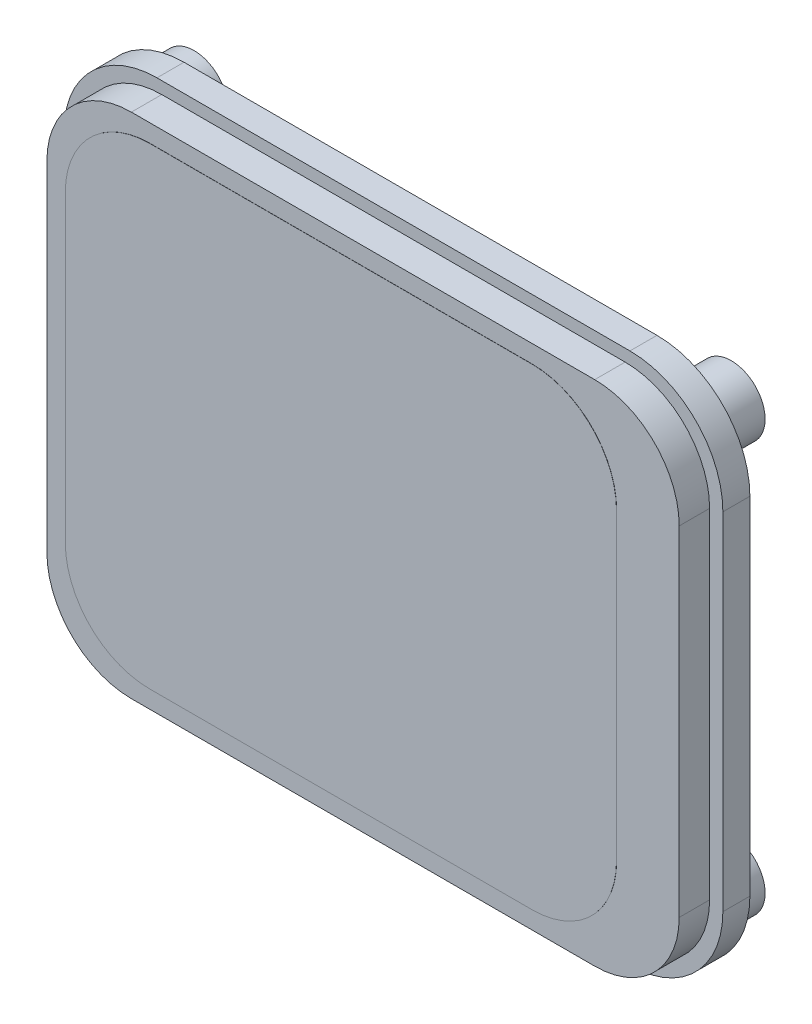
from build123d import *

# Parameters (mm, degrees)
BOSS_EXTRU_1_DEPTH = 0.01
BOSS_EXTRU_2_DEPTH = 1.8
BOSS_EXTRU_3_DEPTH = 1.6
ESQUISSE4_R        = 2
ESQUISSE4_R_2      = 1
BOSS_EXTRU_4_DEPTH = 2.5


with BuildPart() as part:
    # Esquisse1 → Boss.-Extru.1 (new body)
    with BuildSketch(Plane.XY):
        with BuildLine():
            Line((-11.315, -13.985), (11.315, -13.985))
            ThreePointArc((11.315, -13.985), (14.850533906, -12.520533906), (16.315, -8.985))
            Line((16.315, -8.985), (16.315, 8.985))
            ThreePointArc((16.315, 8.985), (14.850533906, 12.520533906), (11.315, 13.985))
            Line((11.315, 13.985), (-11.315, 13.985))
            ThreePointArc((-11.315, 13.985), (-14.850533906, 12.520533906), (-16.315, 8.985))
            Line((-16.315, 8.985), (-16.315, -8.985))
            ThreePointArc((-16.315, -8.985), (-14.850533906, -12.520533906), (-11.315, -13.985))
        make_face()
    extrude(amount=-BOSS_EXTRU_1_DEPTH)

    # Esquisse2 → Boss.-Extru.2 (add)
    with BuildSketch(Plane(origin=(0, 0, -0.01), x_dir=(-1, 0, 0), z_dir=(0, 0, -1))):
        with BuildLine():
            Line((-15.015, -15.035), (12.415, -15.035))
            ThreePointArc((12.415, -15.035), (15.950533906, -13.570533906), (17.415, -10.035))
            Line((17.415, -10.035), (17.415, 10.035))
            ThreePointArc((17.415, 10.035), (15.950533906, 13.570533906), (12.415, 15.035))
            Line((12.415, 15.035), (-15.015, 15.035))
            ThreePointArc((-15.015, 15.035), (-18.550533906, 13.570533906), (-20.015, 10.035))
            Line((-20.015, 10.035), (-20.015, -10.035))
            ThreePointArc((-20.015, -10.035), (-18.550533906, -13.570533906), (-15.015, -15.035))
        make_face()
    extrude(amount=BOSS_EXTRU_2_DEPTH)

    # Esquisse3 → Boss.-Extru.3 (add)
    with BuildSketch(Plane(origin=(0, 0, -1.81), x_dir=(-1, 0, 0), z_dir=(0, 0, -1))):
        with BuildLine():
            Line((-15.3, -15.75), (12.7, -15.75))
            ThreePointArc((12.7, -15.75), (16.589087297, -14.139087297), (18.2, -10.25))
            Line((18.2, -10.25), (18.2, 10.25))
            ThreePointArc((18.2, 10.25), (16.589087297, 14.139087297), (12.7, 15.75))
            Line((12.7, 15.75), (-15.3, 15.75))
            ThreePointArc((-15.3, 15.75), (-19.189087297, 14.139087297), (-20.8, 10.25))
            Line((-20.8, 10.25), (-20.8, -10.25))
            ThreePointArc((-20.8, -10.25), (-19.189087297, -14.139087297), (-15.3, -15.75))
        make_face()
    extrude(amount=BOSS_EXTRU_3_DEPTH)

    # Esquisse4 → Boss.-Extru.4 (add)
    # profile 1 of 4: a face of its own
    with BuildSketch(Plane(origin=(0, 0, -3.41), x_dir=(-1, 0, 0), z_dir=(0, 0, -1))):
        with Locations(Location((-17.2, -12.15, 0), (0, 0, 180))):
            Circle(ESQUISSE4_R)
        with Locations((-17.2, -12.15)):
            Circle(ESQUISSE4_R_2, mode=Mode.SUBTRACT)
    # profile 2 of 4: a face of its own
    with BuildSketch(Plane(origin=(0, 0, -3.41), x_dir=(-1, 0, 0), z_dir=(0, 0, -1))):
        with Locations(Location((14.6, -12.15, 0), (0, 0, 180))):
            Circle(ESQUISSE4_R)
        with Locations((14.6, -12.15)):
            Circle(ESQUISSE4_R_2, mode=Mode.SUBTRACT)
    # profile 3 of 4: a face of its own
    with BuildSketch(Plane(origin=(0, 0, -3.41), x_dir=(-1, 0, 0), z_dir=(0, 0, -1))):
        with Locations(Location((-17.2, 12.15, 0), (0, 0, 180))):
            Circle(ESQUISSE4_R)
        with Locations((-17.2, 12.15)):
            Circle(ESQUISSE4_R_2, mode=Mode.SUBTRACT)
    # profile 4 of 4: a face of its own
    with BuildSketch(Plane(origin=(0, 0, -3.41), x_dir=(-1, 0, 0), z_dir=(0, 0, -1))):
        with Locations(Location((14.6, 12.15, 0), (0, 0, 180))):
            Circle(ESQUISSE4_R)
        with Locations((14.6, 12.15)):
            Circle(ESQUISSE4_R_2, mode=Mode.SUBTRACT)
    extrude(amount=BOSS_EXTRU_4_DEPTH)


solid = part.part
